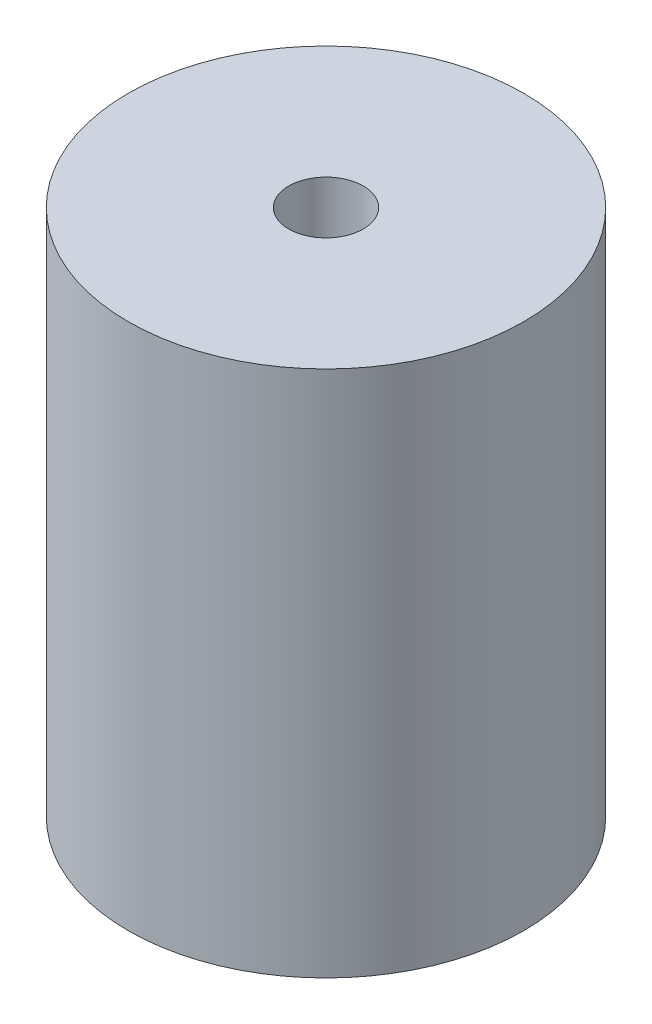
from build123d import *

# Parameters (mm, degrees)
SKETCH5_R           = 38.1
BOSS_EXTRUDE1_DEPTH = 101.6
SKETCH7_R           = 7.184204897
CUT_EXTRUDE1_DEPTH  = 88.9


with BuildPart() as part:
    # Sketch5 → Boss-Extrude1 (new body)
    with BuildSketch(Plane(origin=(0, 0, 0), x_dir=(1, 0, 0), z_dir=(0, 1, 0))):
        with Locations(Location((0, 0, 0), (0, 0, 270))):
            Circle(SKETCH5_R)
    extrude(amount=BOSS_EXTRUDE1_DEPTH)

    # Sketch7 → Cut-Extrude1 (cut)
    with BuildSketch(Plane(origin=(0, 101.6, 0), x_dir=(1, 0, 0), z_dir=(0, 1, 0))):
        with Locations(Location((0, 0, 0), (0, 0, 270))):
            Circle(SKETCH7_R)
    extrude(amount=-CUT_EXTRUDE1_DEPTH, mode=Mode.SUBTRACT)


solid = part.part
